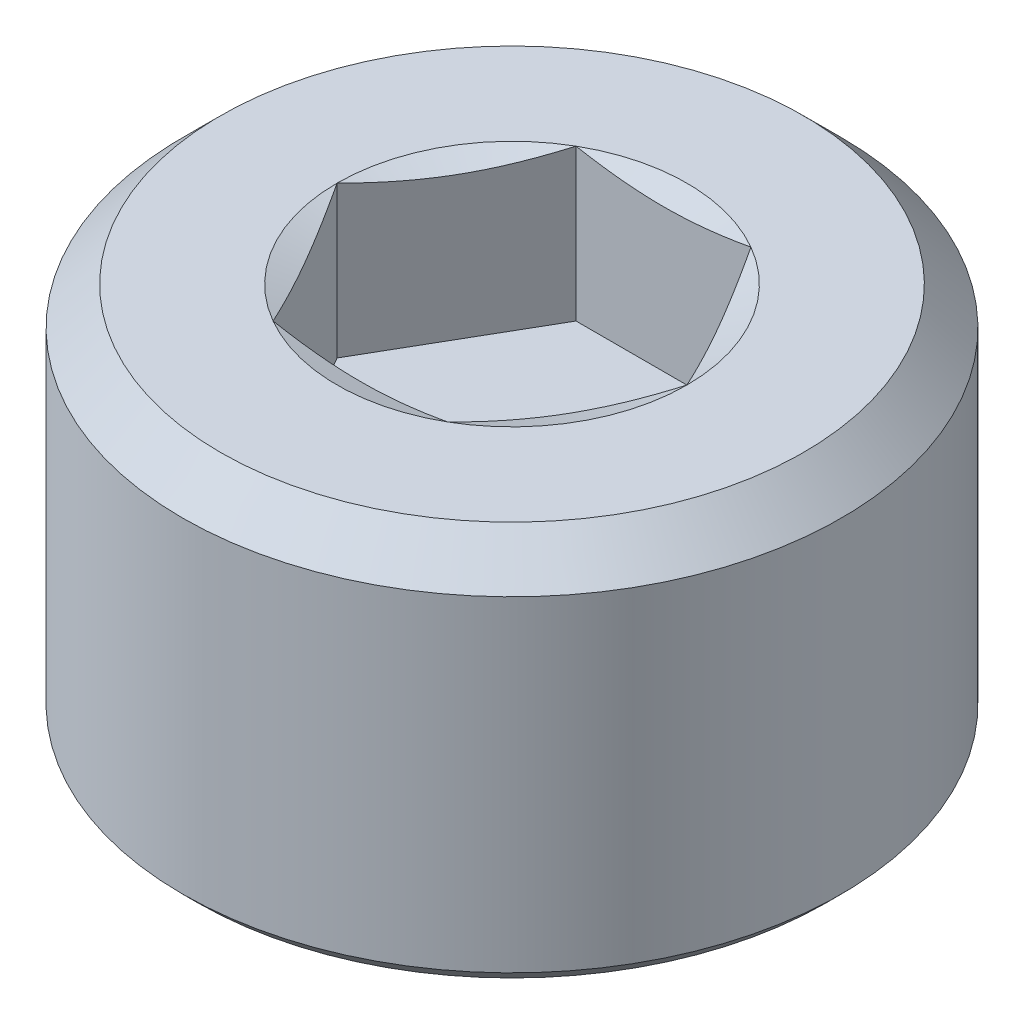
from build123d import *

# Parameters (mm, degrees)
SKETCH_1_R          = 4.35
EXTRUDE_1_DEPTH     = 5
CUT_EXTRUDE_1_DEPTH = 2
SKETCH_3_R          = 2.309401077
SKETCH_4_R          = 1.5
CHAMFER_1_SIZE      = 0.5
CHAMFER_2_SIZE      = 0.2


with BuildPart() as part:
    # 草图1 → 凸台-拉伸1 (new body)
    with BuildSketch(Plane(origin=(0, 0, 0), x_dir=(1, 0, 0), z_dir=(0, 1, 0))):
        with Locations(Location((0, 0, 0), (0, 0, 270))):
            Circle(SKETCH_1_R)
    extrude(amount=EXTRUDE_1_DEPTH)

    # 草图2 → 切除-拉伸1 (cut)
    with BuildSketch(Plane(origin=(0, 5, 0), x_dir=(1, 0, 0), z_dir=(0, 1, 0))):
        Polygon((2.309401077, 0), (1.154700538, 2), (-1.154700538, 2), (-2.309401077, 0), (-1.154700538, -2), (1.154700538, -2), align=None)
    extrude(amount=-CUT_EXTRUDE_1_DEPTH, mode=Mode.SUBTRACT)

    # 草图3 → 切除-放样1 section 0
    with BuildSketch(Plane(origin=(0, 5, 0), x_dir=(1, 0, 0), z_dir=(0, 1, 0))):
        Circle(SKETCH_3_R)
    # 草图4 → 切除-放样1 section 1
    with BuildSketch(Plane(origin=(0, 4.7, 0), x_dir=(1, 0, 0), z_dir=(0, 1, 0))):
        Circle(SKETCH_4_R)
    loft(mode=Mode.SUBTRACT)

    # 倒角1
    chamfer_1_edges = [part.edges().sort_by_distance(p)[0] for p in [
        (0, 5, -4.35),
    ]]
    chamfer(chamfer_1_edges, length=CHAMFER_1_SIZE)

    # 倒角2
    chamfer_2_edges = [part.edges().sort_by_distance(p)[0] for p in [
        (0, 0, -4.35),
    ]]
    chamfer(chamfer_2_edges, length=CHAMFER_2_SIZE)


solid = part.part
